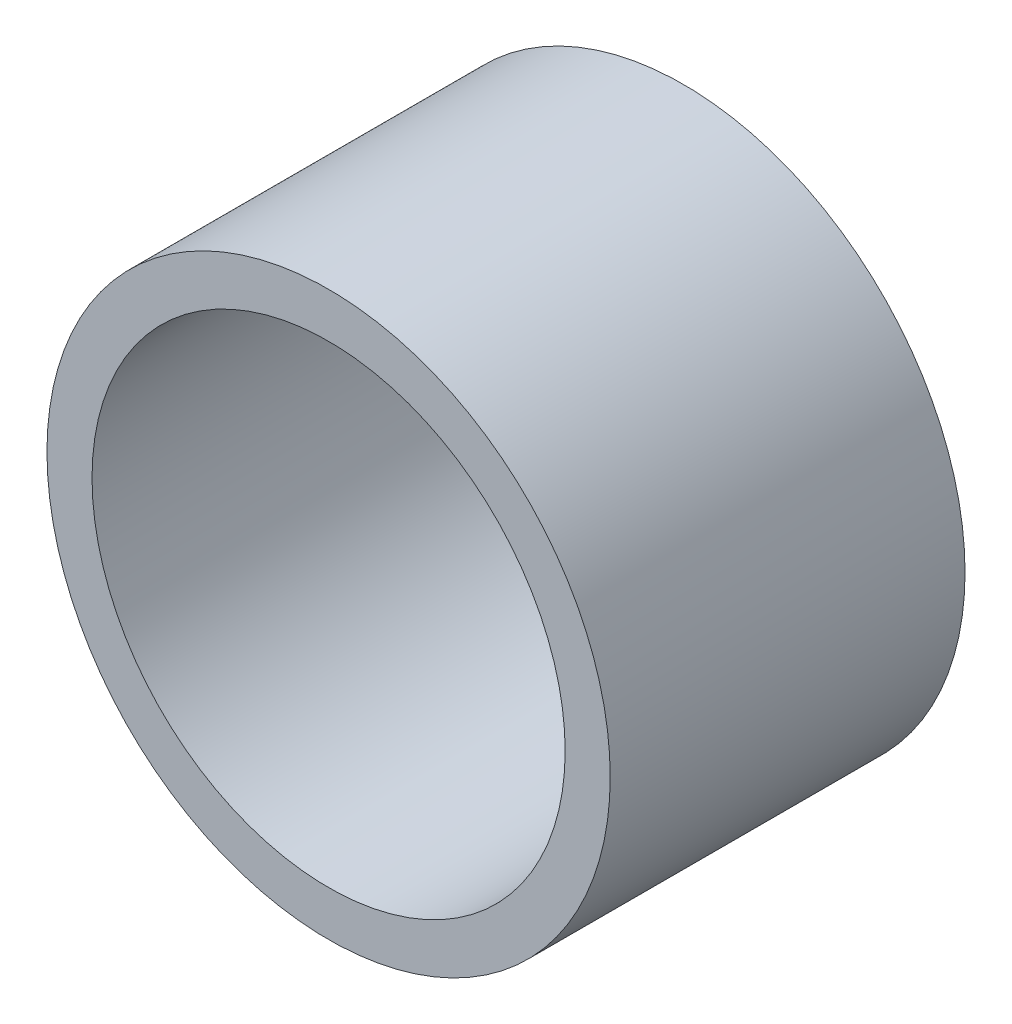
from build123d import *

# Parameters (mm, degrees)
SKETCH1_R           = 3.175
SKETCH1_R_2         = 2.667
BOSS_EXTRUDE1_DEPTH = 4


with BuildPart() as part:
    # Sketch1 → Boss-Extrude1 (new body)
    with BuildSketch(Plane.XY):
        Circle(SKETCH1_R)
        Circle(SKETCH1_R_2, mode=Mode.SUBTRACT)
    extrude(amount=BOSS_EXTRUDE1_DEPTH)


solid = part.part
